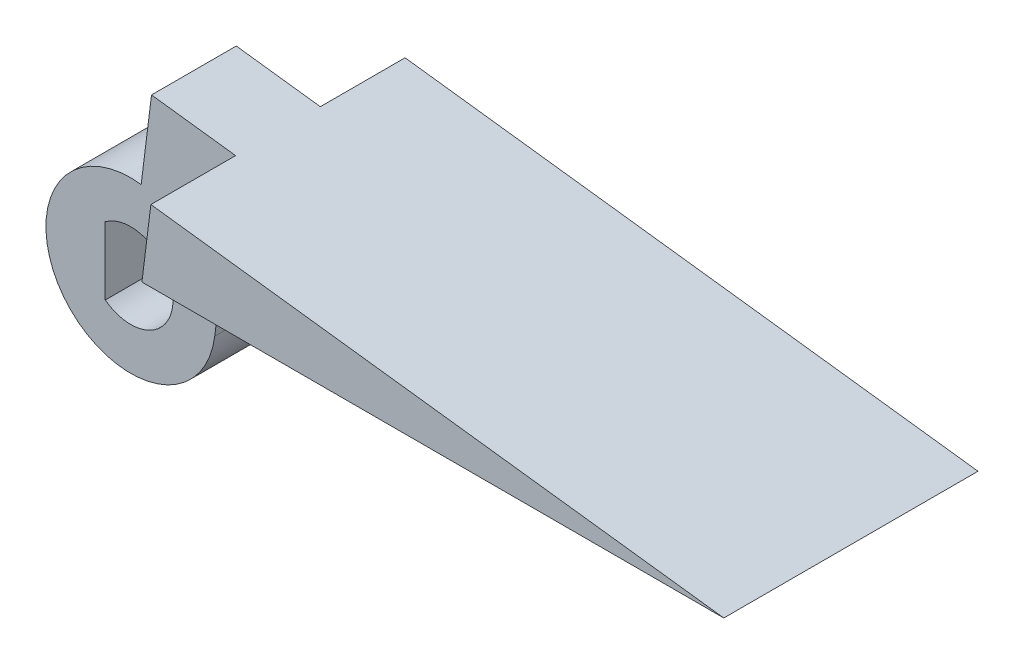
from build123d import *

# Parameters (mm, degrees)
SKETCH1_R               = 3.175
BOSS_EXTRUDE1_DEPTH     = 9.525
CUT_EXTRUDE1_DEPTH      = 6.35
CUT_EXTRUDE2_START      = -19.05
CUT_EXTRUDE2_DEPTH      = 6.35
BOSS_EXTRUDE2_DEPTH     = 6.35
CUT_EXTRUDE5_DEPTH      = 54.858594107
CUT_EXTRUDE5_DEPTH_BACK = 54.858594107


with BuildPart() as part:
    # Sketch1 → Boss-Extrude1 (new, symmetric)
    with BuildSketch(Plane.XY):
        with BuildLine():
            Line((6.300964517, 11.912379435), (50.8, 6.35))
            Line((50.8, 6.35), (7.193167088, 6.35))
            Line((7.193167088, 6.35), (6.300964517, -0.787620565))
            ThreePointArc((6.300964517, -0.787620565), (4.202446277, -4.760456416), (0, -6.35))
            ThreePointArc((0, -6.35), (-4.760456416, -4.202446277), (-6.300964517, 0.787620565))
            ThreePointArc((-6.300964517, 0.787620565), (-4.202446277, 4.760456416), (0, 6.35))
            Line((0, 6.35), (0.781538462, 12.602307692))
            Line((0.781538462, 12.602307692), (6.300964517, 11.912379435))
        make_face()
        with Locations(Location((0, 0, 0), (0, 0, 180))):
            Circle(SKETCH1_R, mode=Mode.SUBTRACT)
    extrude(amount=BOSS_EXTRUDE1_DEPTH, both=True)

    # Sketch2 → Cut-Extrude1 (cut)
    with BuildSketch(Plane.XY.offset(9.525)):
        Polygon((7.193167088, 21.115513253), (-6.35, 21.115513253), (-6.35, 0.257727368), (-6.35, -6.35), (7.193167088, -6.35), (7.193167088, 6.35), (8.941363703, 20.335572925), align=None)
    extrude(amount=-CUT_EXTRUDE1_DEPTH, mode=Mode.SUBTRACT)

    # Sketch2<2> → Cut-Extrude2 (cut)
    with BuildSketch(Plane.XY.offset(9.525).offset(CUT_EXTRUDE2_START)):
        Polygon((7.193167088, 21.115513253), (-6.35, 21.115513253), (-6.35, 0.257727368), (-6.35, -6.35), (7.193167088, -6.35), (7.193167088, 6.35), (8.941363703, 20.335572925), align=None)
    extrude(amount=CUT_EXTRUDE2_DEPTH, mode=Mode.SUBTRACT)

    # Sketch3 → Boss-Extrude2 (add)
    with BuildSketch(Plane.XY.offset(3.175)):
        with BuildLine():
            Line((-1.905, 2.54), (-1.905, -2.54))
            ThreePointArc((-1.905, -2.54), (-3.175, 0), (-1.905, 2.54))
        make_face()
    extrude(amount=-BOSS_EXTRUDE2_DEPTH)

    # Sketch4 → Cut-Extrude5 (cut, two sides: drawn at the far end of the back side and taken through both)
    with BuildSketch(Plane.XY.offset(3.175).offset(-CUT_EXTRUDE5_DEPTH_BACK)):
        with BuildLine():
            Line((0.787620565, 6.300964517), (1.563076923, 12.504615385))
            Line((1.563076923, 12.504615385), (-1.51572631, 12.889465789))
            Line((-1.51572631, 12.889465789), (-2.391608705, 5.882406634))
            ThreePointArc((-2.391608705, 5.882406634), (-0.828849904, 6.29567374), (0.787620565, 6.300964517))
        make_face()
    extrude(amount=CUT_EXTRUDE5_DEPTH + CUT_EXTRUDE5_DEPTH_BACK, mode=Mode.SUBTRACT)


solid = part.part
